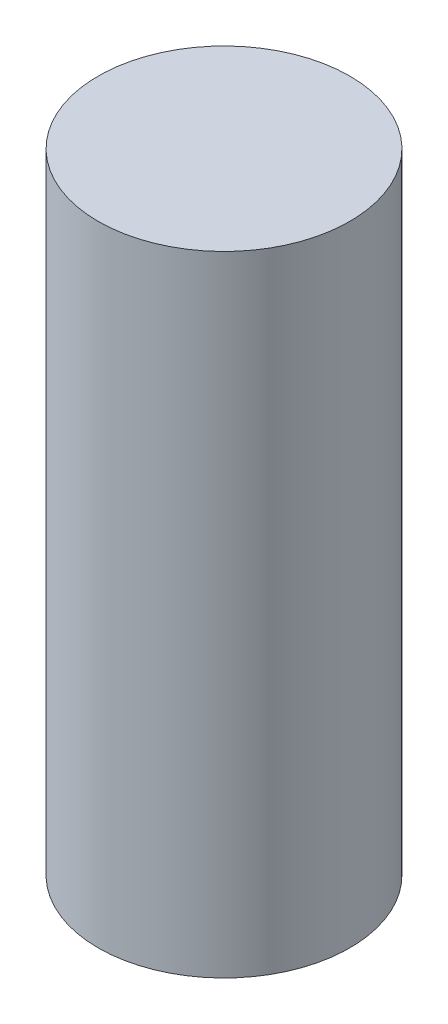
from build123d import *

# Parameters (mm, degrees)
SKETCH_1_W = 6
SKETCH_1_H = 30


with BuildPart() as part:
    # 草图1 → Revolve 2 (revolve)
    with BuildSketch(Plane.XY, mode=Mode.PRIVATE) as revolve_2_sk:
        with Locations((3, 15)):
            Rectangle(SKETCH_1_W, SKETCH_1_H)
    revolve(revolve_2_sk.sketch.rotate(Axis((0, 0, 0), (0, 1, 0)), 90), axis=Axis((0, 0, 0), (0, 1, 0)))


solid = part.part
